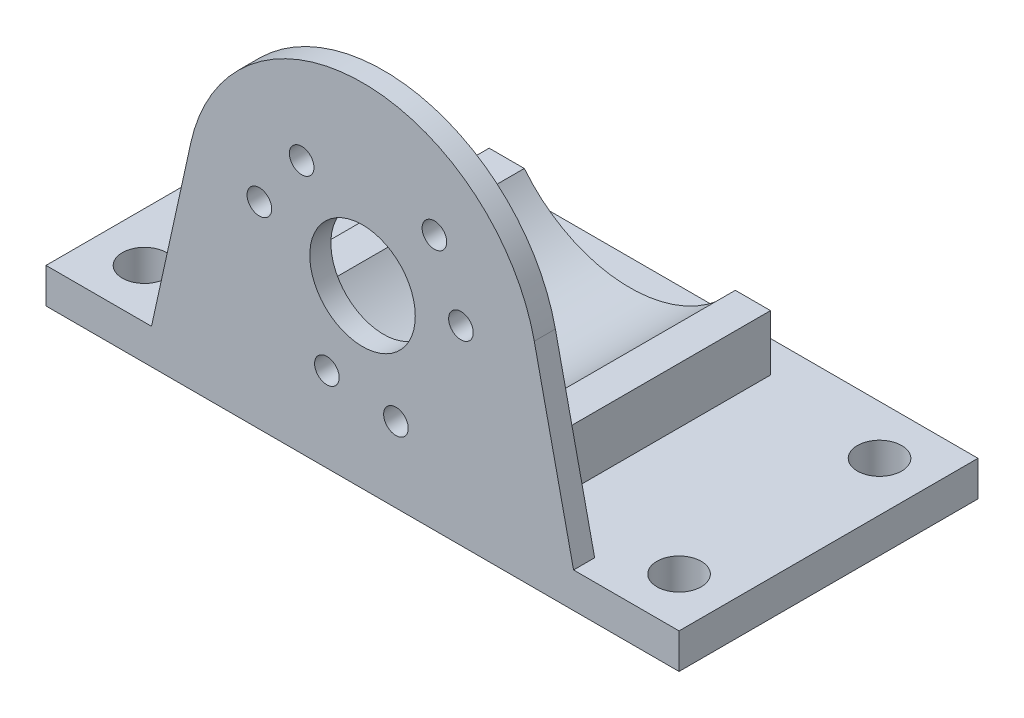
from build123d import *

# Parameters (mm, degrees)
SKETCH3_W           = 90
SKETCH3_H           = 42.5
SKETCH3_R           = 3.15
BOSS_EXTRUDE1_DEPTH = 5
SKETCH4_R           = 1.75
SKETCH4_R_2         = 7.5
BOSS_EXTRUDE2_DEPTH = 3
SKETCH5_W           = 5
SKETCH5_H           = 7.935071488
BOSS_EXTRUDE3_DEPTH = 35


with BuildPart() as part:
    # Sketch3 → Boss-Extrude1 (new body)
    with BuildSketch(Plane(origin=(0, 0, 0), x_dir=(1, 0, 0), z_dir=(0, 1, 0))):
        Rectangle(SKETCH3_W, SKETCH3_H)
        with Locations(Location((-38, 14.25, 0), (0, 0, 270))):
            Circle(SKETCH3_R, mode=Mode.SUBTRACT)
        with Locations(Location((38, 14.25, 0), (0, 0, 90))):
            Circle(SKETCH3_R, mode=Mode.SUBTRACT)
        with Locations(Location((38, -14.25, 0), (0, 0, 270))):
            Circle(SKETCH3_R, mode=Mode.SUBTRACT)
        with Locations(Location((-38, -14.25, 0), (0, 0, 90))):
            Circle(SKETCH3_R, mode=Mode.SUBTRACT)
    extrude(amount=BOSS_EXTRUDE1_DEPTH)

    # Sketch4 → Boss-Extrude2 (add)
    with BuildSketch(Plane.XY.offset(21.25)):
        with BuildLine():
            Line((-30, 5), (30, 5))
            Line((30, 5), (24.415677736, 30.373516604))
            ThreePointArc((24.415677736, 30.373516604), (0, 50), (-24.415677736, 30.373516604))
            Line((-24.415677736, 30.373516604), (-30, 5))
        make_face()
        with Locations((10.21923709, 36.347341968)):
            Circle(SKETCH4_R, mode=Mode.SUBTRACT)
        with Locations((-5.067303705, 12.010919994)):
            Circle(SKETCH4_R, mode=Mode.SUBTRACT)
        with Locations((4.749376983, 10.674714152)):
            Circle(SKETCH4_R, mode=Mode.SUBTRACT)
        with Locations((0, 25)):
            Circle(SKETCH4_R_2, mode=Mode.SUBTRACT)
        with Locations((13.990382911, 27.080076467)):
            Circle(SKETCH4_R, mode=Mode.SUBTRACT)
        with Locations((-14.667309102, 27.992284383)):
            Circle(SKETCH4_R, mode=Mode.SUBTRACT)
        with Locations((-8.654917128, 36.087456884)):
            Circle(SKETCH4_R, mode=Mode.SUBTRACT)
    extrude(amount=-BOSS_EXTRUDE2_DEPTH)

    # Sketch5 → Boss-Extrude3 (add)
    with BuildSketch(Plane(origin=(0, 0, 18.25), x_dir=(-1, 0, 0), z_dir=(0, 0, -1))):
        with BuildLine():
            ThreePointArc((15, 12.935071488), (0, 5.75), (-15, 12.935071488))
            Line((-15, 12.935071488), (-15, 5))
            Line((-15, 5), (15, 5))
            Line((15, 5), (15, 12.935071488))
        make_face()
        with Locations((-17.5, 8.967535744)):
            Rectangle(SKETCH5_W, SKETCH5_H)
        with Locations((17.5, 8.967535744)):
            Rectangle(SKETCH5_W, SKETCH5_H)
    extrude(amount=BOSS_EXTRUDE3_DEPTH)


solid = part.part
